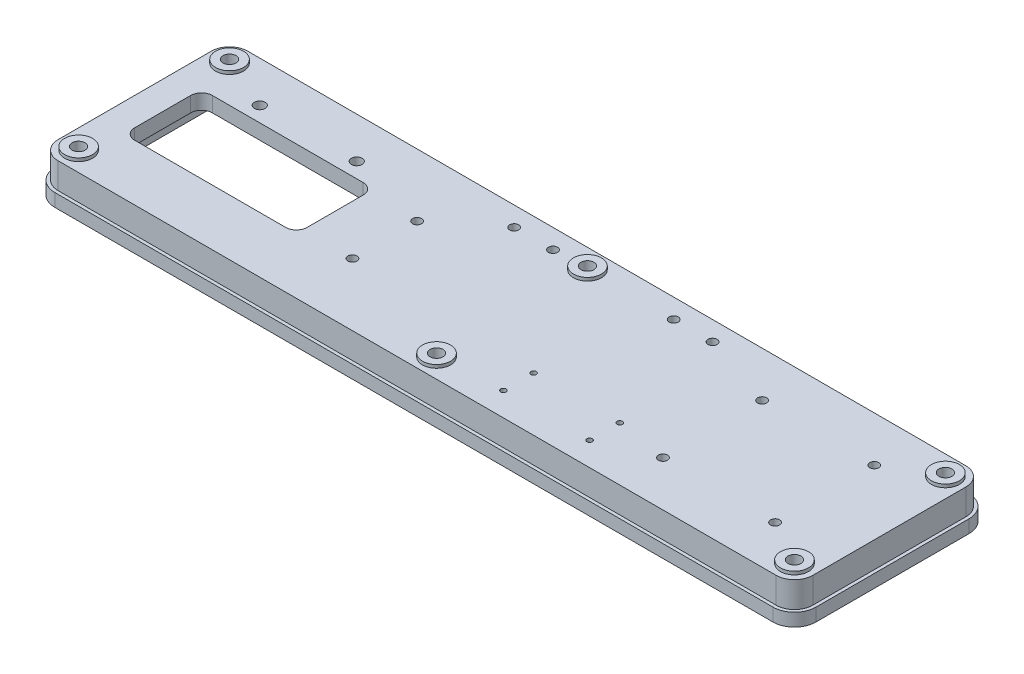
from build123d import *

# Parameters (mm, degrees)
SKETCH1_W                = 353
SKETCH1_H                = 91
BOSS_EXTRUDE1_DEPTH      = 18
FILLET1_R                = 10
SKETCH3_OUTSIDE_W        = 427.996
SKETCH3_OUTSIDE_H        = 165.996
CUT_EXTRUDE1_DEPTH       = 12
CUT_EXTRUDE2_DEPTH       = 11
SKETCH5_R                = 6.5
BOSS_EXTRUDE2_DEPTH      = 1.5
CUT_EXTRUDE3_REACH       = 185.157
SKETCH8_W                = 80
SKETCH8_H                = 36
FILLET2_R                = 5
F_6_0_6_DIAMETER_HOLE1_D = 6
M5X0_8_TAPPED_HOLE1_D    = 4.2
M6X1_0_TAPPED_HOLE1_D    = 5
M3X0_5_TAPPED_HOLE1_D    = 2.5


with BuildPart() as part:
    # Sketch1 → Boss-Extrude1 (new body)
    with BuildSketch(Plane(origin=(0, 0, 0), x_dir=(1, 0, 0), z_dir=(0, 1, 0))):
        Rectangle(SKETCH1_W, SKETCH1_H)
    extrude(amount=BOSS_EXTRUDE1_DEPTH)

    # Fillet1
    fillet1_edges = [part.edges().sort_by_distance(p)[0] for p in [
        (-176.5, 9, -45.5),
        (176.5, 9, -45.5),
        (176.5, 9, 45.5),
        (-176.5, 9, 45.5),
    ]]
    fillet(fillet1_edges, radius=FILLET1_R)

    # Sketch3 outside → Cut-Extrude1 (cut)
    with BuildSketch(Plane(origin=(0, 18, 0), x_dir=(1, 0, 0), z_dir=(0, 1, 0))):
        Rectangle(SKETCH3_OUTSIDE_W, SKETCH3_OUTSIDE_H)
        with BuildLine():
            Line((-175, 35.5), (-175, -35.5))
            ThreePointArc((-175, -35.5), (-172.51040764, -41.51040764), (-166.5, -44))
            Line((-166.5, -44), (166.5, -44))
            ThreePointArc((166.5, -44), (172.51040764, -41.51040764), (175, -35.5))
            Line((175, -35.5), (175, 35.5))
            ThreePointArc((175, 35.5), (172.51040764, 41.51040764), (166.5, 44))
            Line((166.5, 44), (-166.5, 44))
            ThreePointArc((-166.5, 44), (-172.51040764, 41.51040764), (-175, 35.5))
        make_face(mode=Mode.SUBTRACT)
    extrude(amount=-CUT_EXTRUDE1_DEPTH, mode=Mode.SUBTRACT)

    # Sketch4 → Cut-Extrude2 (cut)
    with BuildSketch(Plane.XZ):
        with BuildLine():
            Line((-170, 35.5), (-170, -35.5))
            ThreePointArc((-170, -35.5), (-168.974873734, -37.974873734), (-166.5, -39))
            Line((-166.5, -39), (166.5, -39))
            ThreePointArc((166.5, -39), (168.974873734, -37.974873734), (170, -35.5))
            Line((170, -35.5), (170, 35.5))
            ThreePointArc((170, 35.5), (168.974873734, 37.974873734), (166.5, 39))
            Line((166.5, 39), (-166.5, 39))
            ThreePointArc((-166.5, 39), (-168.974873734, 37.974873734), (-170, 35.5))
        make_face()
    extrude(amount=-CUT_EXTRUDE2_DEPTH, mode=Mode.SUBTRACT)

    # Sketch5 → Boss-Extrude2 (add)
    with BuildSketch(Plane(origin=(0, 18, 0), x_dir=(1, 0, 0), z_dir=(0, 1, 0))):
        with Locations(Location((-166, 35, 0), (0, 0, 270))):
            Circle(SKETCH5_R)
        with Locations(Location((-166, -35, 0), (0, 0, 270))):
            Circle(SKETCH5_R)
        with Locations(Location((0, 35, 0), (0, 0, 270))):
            Circle(SKETCH5_R)
        with Locations(Location((0, -35, 0), (0, 0, 270))):
            Circle(SKETCH5_R)
        with Locations(Location((166, 35, 0), (0, 0, 270))):
            Circle(SKETCH5_R)
        with Locations(Location((166, -35, 0), (0, 0, 270))):
            Circle(SKETCH5_R)
    extrude(amount=BOSS_EXTRUDE2_DEPTH)

    # Sketch8 → Cut-Extrude3 (cut, up to next)
    with BuildSketch(Plane(origin=(0, 18, 0), x_dir=(1, 0, 0), z_dir=(0, 1, 0)), mode=Mode.PRIVATE) as cut_extrude3_sk1:
        with Locations((-122, 0)):
            Rectangle(SKETCH8_W, SKETCH8_H)
    cut_extrude3_tool1 = extrude(cut_extrude3_sk1.sketch, amount=-CUT_EXTRUDE3_REACH, mode=Mode.PRIVATE) & part.part
    add(cut_extrude3_tool1.solids().sort_by_distance((-122, 18, 0))[0], mode=Mode.SUBTRACT)

    # Fillet2
    fillet2_edges = [part.edges().sort_by_distance(p)[0] for p in [
        (-162, 14.5, 18),
        (-162, 14.5, -18),
        (-82, 14.5, -18),
        (-82, 14.5, 18),
    ]]
    fillet(fillet2_edges, radius=FILLET2_R)

    # Ø6.0 (6) Diameter Hole1 (through all)
    with Locations(Plane(origin=(0, 19.5, 0), x_dir=(1, 0, 0), z_dir=(0, 1, 0))):
        with Locations((-166, -35), (-166, 35), (0, 35), (0, -35), (166, 35), (166, -35)):
            Hole(F_6_0_6_DIAMETER_HOLE1_D / 2)

    # M5x0.8 Tapped Hole1 (through all)
    with Locations(Plane(origin=(0, 18, 0), x_dir=(1, 0, 0), z_dir=(0, 1, 0))):
        with Locations((-34, 35), (-16, 35), (40, 35), (58, 35), (-59, 15), (-59, -15), (93, -23), (145, -23), (145, 23), (93, 23)):
            Hole(M5X0_8_TAPPED_HOLE1_D / 2)

    # M6x1.0 Tapped Hole1 (through all)
    with Locations(Plane(origin=(0, 18, 0), x_dir=(1, 0, 0), z_dir=(0, 1, 0))):
        with Locations((-142, 25), (-97, 25)):
            Hole(M6X1_0_TAPPED_HOLE1_D / 2)

    # M3x0.5 Tapped Hole1 (through all)
    with Locations(Plane(origin=(0, 18, 0), x_dir=(1, 0, 0), z_dir=(0, 1, 0))):
        with Locations((29, -33), (69, -33), (69, -19), (29, -19)):
            Hole(M3X0_5_TAPPED_HOLE1_D / 2)


solid = part.part
